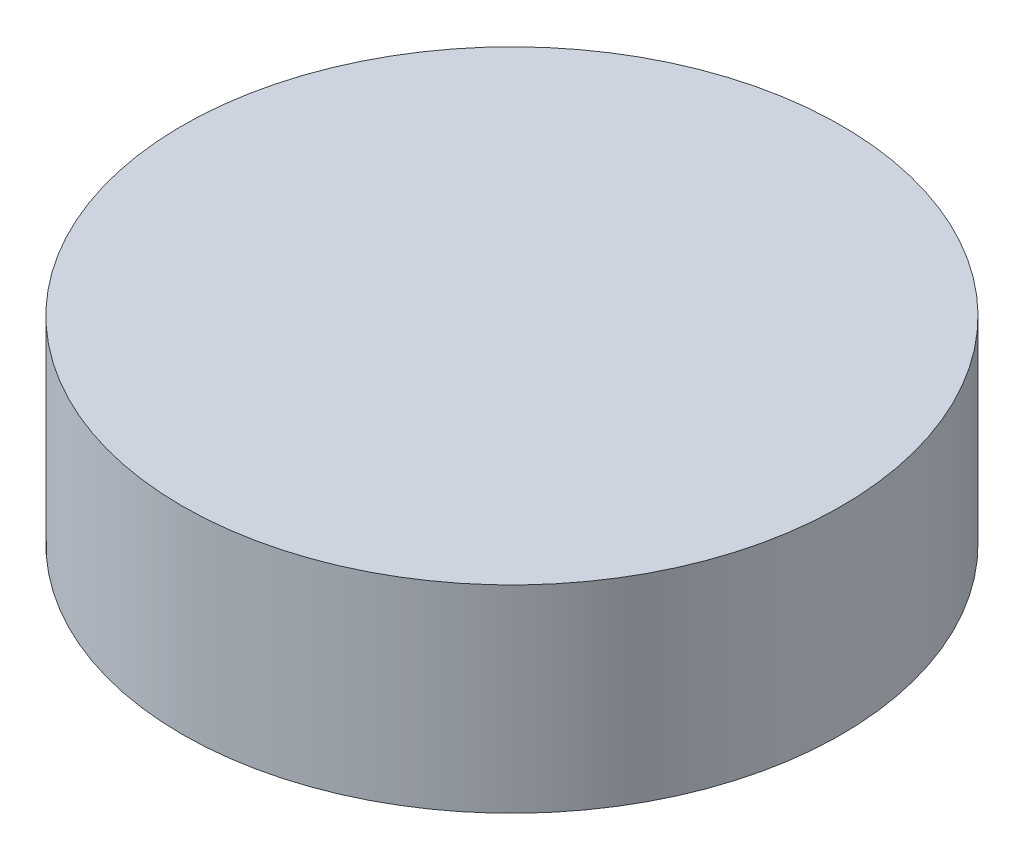
from build123d import *

# Parameters (mm, degrees)
SKETCH1_R           = 5
BOSS_EXTRUDE1_DEPTH = 3


with BuildPart() as part:
    # Sketch1 → Boss-Extrude1 (new body)
    with BuildSketch(Plane(origin=(0, 0, 0), x_dir=(1, 0, 0), z_dir=(0, 1, 0))):
        with Locations(Location((0, 0, 0), (0, 0, 270))):
            Circle(SKETCH1_R)
    extrude(amount=BOSS_EXTRUDE1_DEPTH)


solid = part.part
